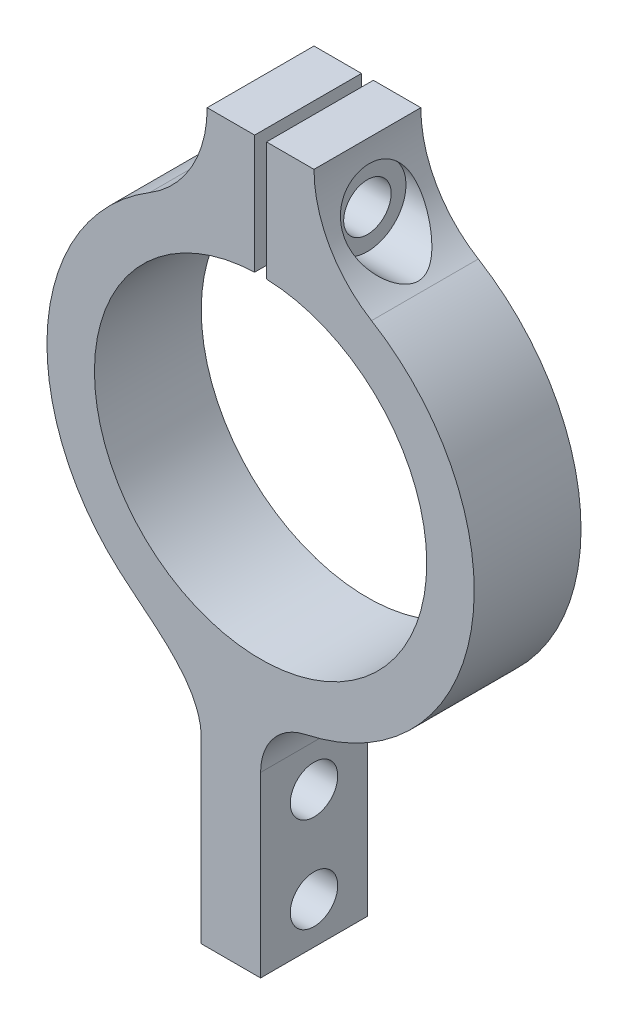
from build123d import *

# Parameters (mm, degrees)
BOSS_EXTRUDE1_DEPTH     = 18
CUT_EXTRUDE4_DEPTH      = 86.122527954
CUT_EXTRUDE4_DEPTH_BACK = 86.122527954
SKETCH7_R               = 4
SKETCH8_R               = 6.5
CUT_EXTRUDE5_DEPTH      = 18
CUT_EXTRUDE6_START      = -18
SKETCH10_R              = 6.5
CUT_EXTRUDE6_DEPTH      = 18
SKETCH12_R              = 4
CUT_EXTRUDE7_DEPTH      = 85.692648826


with BuildPart() as part:
    # Sketch1 → Boss-Extrude1 (new body)
    with BuildSketch(Plane.XY):
        with BuildLine():
            Line((0, -44.517412324), (0, -74.517412324))
            Line((0, -74.517412324), (-10, -74.517412324))
            Line((-10, -74.517412324), (-10, -44.517412324))
            add(Edge.make_bspline(
                [(-23.881707028, -26.938152673), (-18.294689626, -31.891258195), (-10, -36.821023575), (-10, -44.517412324)],
                knots=[0, 0, 0, 0, 1, 1, 1, 1], degree=3))
            ThreePointArc((-23.881707028, -26.938152673), (-35.855411942, 3.223264562), (-18.694362018, 30.765578635))
            ThreePointArc((-18.694362018, 30.765578635), (-11.589893335, 38.113065001), (-9, 48))
            Line((-9, 48), (-1, 48))
            Line((-1, 48), (-1, 27.982137159))
            ThreePointArc((-1, 27.982137159), (0, -28), (1, 27.982137159))
            Line((1, 27.982137159), (1, 48))
            Line((1, 48), (9, 48))
            ThreePointArc((9, 48), (11.589893335, 38.113065001), (18.694362018, 30.765578635))
            ThreePointArc((18.694362018, 30.765578635), (35.495463651, -6.006002016), (7.532125206, -35.203225561))
            ThreePointArc((7.532125206, -35.203225561), (2.11865956, -38.528109669), (0, -44.517412324))
        make_face()
    extrude(amount=BOSS_EXTRUDE1_DEPTH)

    # Sketch7 → Cut-Extrude4 (cut, two sides: drawn at the far end of the back side and taken through both)
    with BuildSketch(Plane.ZY.offset(-1).offset(-CUT_EXTRUDE4_DEPTH_BACK)):
        with Locations((9, 37.99106858)):
            Circle(SKETCH7_R)
    extrude(amount=CUT_EXTRUDE4_DEPTH + CUT_EXTRUDE4_DEPTH_BACK, mode=Mode.SUBTRACT)

    # Sketch8 → Cut-Extrude5 (cut)
    with BuildSketch(Plane(origin=(-9, 0, 0), x_dir=(0, 0, -1), z_dir=(1, 0, 0))):
        with Locations((-9, 37.99106858)):
            Circle(SKETCH8_R)
    extrude(amount=-CUT_EXTRUDE5_DEPTH, mode=Mode.SUBTRACT)

    # Sketch10 → Cut-Extrude6 (cut)
    with BuildSketch(Plane.ZY.offset(-9).offset(CUT_EXTRUDE6_START)):
        with Locations(Location((9, 37.99106858, 0), (0, 0, 180))):
            Circle(SKETCH10_R)
    extrude(amount=CUT_EXTRUDE6_DEPTH, mode=Mode.SUBTRACT)

    # Sketch12 → Cut-Extrude7 (cut, through all)
    with BuildSketch(Plane(origin=(0, 0, 0), x_dir=(0, 0, -1), z_dir=(1, 0, 0))):
        with Locations(Location((-9, -51.517412324, 0), (0, 0, 90))):
            Circle(SKETCH12_R)
        with Locations(Location((-9, -67.517412324, 0), (0, 0, 90))):
            Circle(SKETCH12_R)
    extrude(amount=-CUT_EXTRUDE7_DEPTH, mode=Mode.SUBTRACT)


solid = part.part
